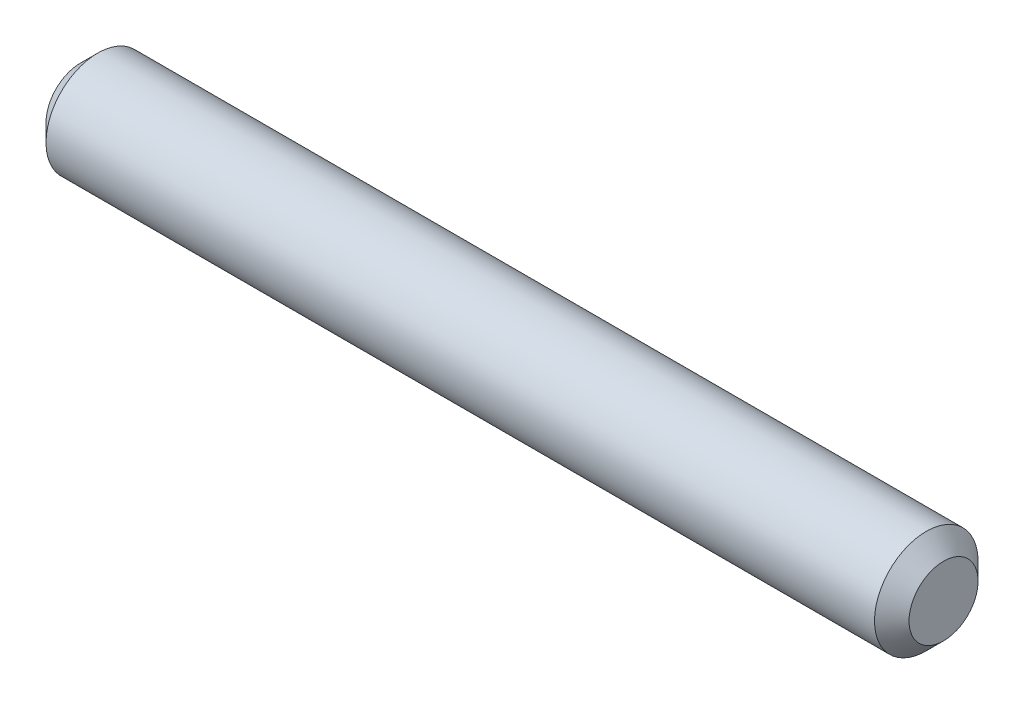
from build123d import *


with BuildPart() as part:
    # Sketch1 → Revolve1 (revolve)
    with BuildSketch(Plane.XY, mode=Mode.PRIVATE) as revolve1_sk:
        Polygon((4, 0), (4, 1), (4.5, 1.5), (28.5, 1.5), (29, 1), (29, 0), align=None)
    revolve(revolve1_sk.sketch.rotate(Axis((0, 0, 0), (1, 0, 0)), 90), axis=Axis((0, 0, 0), (1, 0, 0)))


solid = part.part
